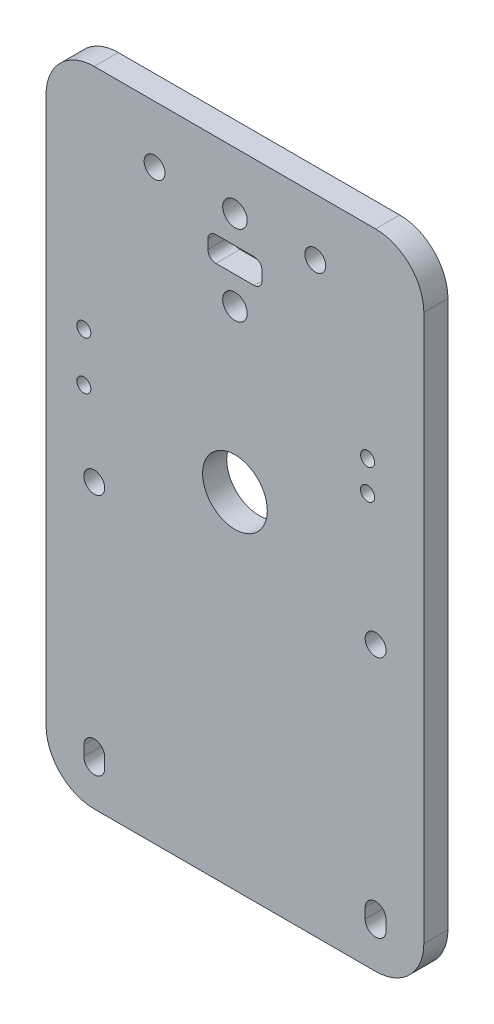
from build123d import *

# Parameters (mm, degrees)
MODEL_R           = 3.05
MODEL_R_2         = 2.6
MODEL_W           = 13.5
MODEL_H           = 6.2
BASE_DEPTH        = 6
SKETCH_1_R        = 8.05
BEARINGHOLE_DEPTH = 10
SKETCH1_R         = 1.75
SENSORMOUNT_DEPTH = 10
SKETCH3_R         = 1.75
CABLEMOUNT_DEPTH  = 10
FILLETCABLESLOT_R = 2


with BuildPart() as part:
    # Model → Base (new body)
    with BuildSketch(Plane.XY):
        with BuildLine():
            Line((-35, 160), (35, 160))
            ThreePointArc((35, 160), (43.485281374, 156.485281374), (47, 148))
            Line((47, 148), (47, 12))
            ThreePointArc((47, 12), (43.485281374, 3.514718626), (35, 0))
            Line((35, 0), (-35, 0))
            ThreePointArc((-35, 0), (-43.485281374, 3.514718626), (-47, 12))
            Line((-47, 12), (-47, 148))
            ThreePointArc((-47, 148), (-43.485281374, 156.485281374), (-35, 160))
        make_face()
        with Locations((0, 145.8)):
            Circle(MODEL_R, mode=Mode.SUBTRACT)
        with Locations((-20, 145.8)):
            Circle(MODEL_R_2, mode=Mode.SUBTRACT)
        with Locations((20, 145.8)):
            Circle(MODEL_R_2, mode=Mode.SUBTRACT)
        with Locations((-35, 70.45)):
            Circle(MODEL_R_2, mode=Mode.SUBTRACT)
        with Locations((0, 125.8)):
            Circle(MODEL_R, mode=Mode.SUBTRACT)
        with Locations((35, 70.45)):
            Circle(MODEL_R_2, mode=Mode.SUBTRACT)
        with BuildLine():
            Line((-32.4, 12.5), (-32.4, 10))
            ThreePointArc((-32.4, 10), (-35, 7.4), (-37.6, 10))
            Line((-37.6, 10), (-37.6, 12.5))
            ThreePointArc((-37.6, 12.5), (-35, 15.1), (-32.4, 12.5))
        make_face(mode=Mode.SUBTRACT)
        with BuildLine():
            Line((32.4, 12.5), (32.4, 10))
            ThreePointArc((32.4, 10), (35, 7.4), (37.6, 10))
            Line((37.6, 10), (37.6, 12.5))
            ThreePointArc((37.6, 12.5), (35, 15.1), (32.4, 12.5))
        make_face(mode=Mode.SUBTRACT)
        with Locations((0, 135.8)):
            Rectangle(MODEL_W, MODEL_H, mode=Mode.SUBTRACT)
    extrude(amount=BASE_DEPTH)

    # Эскиз1 → BearingHole (cut)
    with BuildSketch(Plane(origin=(0, 0, 0), x_dir=(-1, 0, 0), z_dir=(0, 0, -1))):
        with Locations((0, 85.8)):
            Circle(SKETCH_1_R)
    extrude(amount=-BEARINGHOLE_DEPTH, mode=Mode.SUBTRACT)

    # Sketch1 → SensorMount (cut)
    with BuildSketch(Plane.XY.offset(6)):
        with Locations((33, 109.5)):
            Circle(SKETCH1_R)
        with Locations((33, 102)):
            Circle(SKETCH1_R)
    extrude(amount=-SENSORMOUNT_DEPTH, mode=Mode.SUBTRACT)

    # Sketch3 → CableMount (cut)
    with BuildSketch(Plane(origin=(0, 0, 0), x_dir=(-1, 0, 0), z_dir=(0, 0, -1))):
        with Locations((37.6, 90.08855339)):
            Circle(SKETCH3_R)
        with Locations((37.6, 102.08855339)):
            Circle(SKETCH3_R)
    extrude(amount=-CABLEMOUNT_DEPTH, mode=Mode.SUBTRACT)

    # FilletCableSlot
    filletcableslot_edges = [part.edges().sort_by_distance(p)[0] for p in [
        (6.75, 132.7, 3),
        (6.75, 138.9, 3),
        (-6.75, 138.9, 3),
        (-6.75, 132.7, 3),
    ]]
    fillet(filletcableslot_edges, radius=FILLETCABLESLOT_R)


solid = part.part
